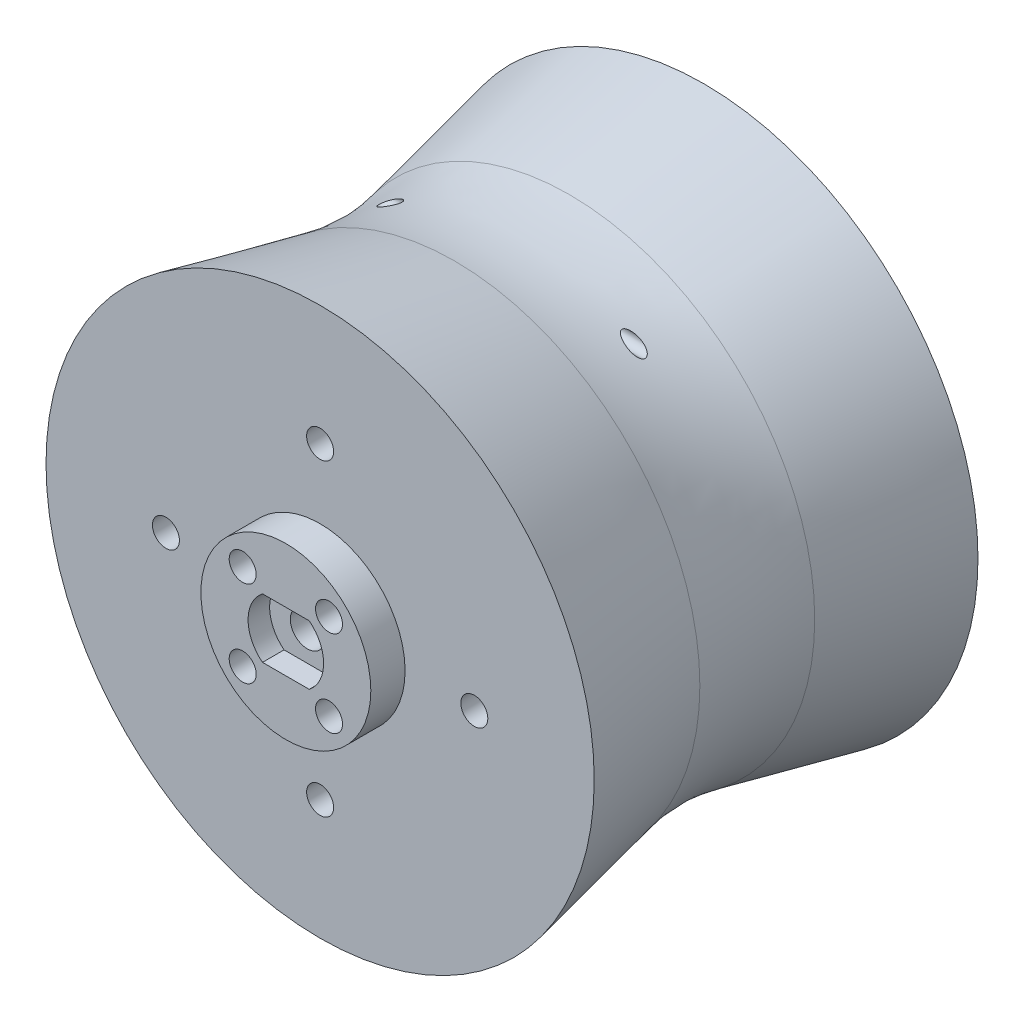
from build123d import *

# Parameters (mm, degrees)
SKETCH1_R               = 50.8
SKETCH1_R_2             = 3.175
BOSS_EXTRUDE1_DEPTH     = 71.12
CUT_EXTRUDE1_DEPTH      = 102.09072361
CUT_EXTRUDE1_DEPTH_BACK = 102.09072361
SKETCH2_R               = 1.27
SKETCH7_R               = 2.5
CUT_EXTRUDE4_DEPTH      = 12.7
SKETCH8_R               = 15.748
SKETCH8_R_2             = 3.175
BOSS_EXTRUDE2_DEPTH     = 6.35
CUT_EXTRUDE6_DEPTH      = 4
SKETCH6_R               = 2.5
CUT_EXTRUDE7_DEPTH      = 7


with BuildPart() as part:
    # Sketch1 → Boss-Extrude1 (new body)
    with BuildSketch(Plane.XY):
        Circle(SKETCH1_R)
        Circle(SKETCH1_R_2, mode=Mode.SUBTRACT)
    extrude(amount=BOSS_EXTRUDE1_DEPTH)

    # Sketch2 → Cut-Extrude1 (cut, two sides: drawn at the far end of the back side and taken through both)
    with BuildSketch(Plane(origin=(0, 0, 0), x_dir=(0, 0, -1), z_dir=(1, 0, 0)).offset(-CUT_EXTRUDE1_DEPTH_BACK)):
        with Locations((-35.56, 38.1)):
            Circle(SKETCH2_R)
    extrude(amount=CUT_EXTRUDE1_DEPTH + CUT_EXTRUDE1_DEPTH_BACK, mode=Mode.SUBTRACT)

    # Sketch7 → Cut-Extrude4 (cut)
    with BuildSketch(Plane(origin=(0, 0, 0), x_dir=(-1, 0, 0), z_dir=(0, 0, -1))):
        with Locations((28.575, 0)):
            Circle(SKETCH7_R)
        with Locations((0, 28.575)):
            Circle(SKETCH7_R)
        with Locations((-28.575, 0)):
            Circle(SKETCH7_R)
        with Locations((0, -28.575)):
            Circle(SKETCH7_R)
    cut_extrude4 = extrude(amount=-CUT_EXTRUDE4_DEPTH, mode=Mode.SUBTRACT)

    # Mirror1: Cut-Extrude4 across plane
    add(cut_extrude4.mirror(Plane.XY.offset(35.56)), mode=Mode.SUBTRACT)

    # Sketch8 → Boss-Extrude2 (add)
    with BuildSketch(Plane.XY.offset(71.12)):
        Circle(SKETCH8_R)
        Circle(SKETCH8_R_2, mode=Mode.SUBTRACT)
    extrude(amount=BOSS_EXTRUDE2_DEPTH)

    # Sketch5 → Cut-Extrude6 (cut)
    with BuildSketch(Plane.XY.offset(77.47)):
        with BuildLine():
            Line((-4.330127019, 5.5), (4.330127019, 5.5))
            ThreePointArc((4.330127019, 5.5), (7, 0), (4.330127019, -5.5))
            Line((4.330127019, -5.5), (-4.330127019, -5.5))
            ThreePointArc((-4.330127019, -5.5), (-7, 0), (-4.330127019, 5.5))
        make_face()
    extrude(amount=-CUT_EXTRUDE6_DEPTH, mode=Mode.SUBTRACT)

    # Sketch6 → Cut-Extrude7 (cut)
    with BuildSketch(Plane.XY.offset(77.47)):
        with Locations((-8, 8)):
            Circle(SKETCH6_R)
        with Locations((8, 8)):
            Circle(SKETCH6_R)
        with Locations((8, -8)):
            Circle(SKETCH6_R)
        with Locations((-8, -8)):
            Circle(SKETCH6_R)
    extrude(amount=-CUT_EXTRUDE7_DEPTH, mode=Mode.SUBTRACT)

    # Sketch9 → Cut-Revolve1 (revolve, cut)
    with BuildSketch(Plane(origin=(0, 0, 0), x_dir=(0, 0, -1), z_dir=(1, 0, 0)), mode=Mode.PRIVATE) as cut_revolve1_sk:
        with BuildLine():
            Line((-71.12, 50.8), (-46.204077708, 45.460873794))
            ThreePointArc((-46.204077708, 45.460873794), (-35.56, 44.33323643), (-24.915922292, 45.460873794))
            Line((-24.915922292, 45.460873794), (0, 50.8))
            Line((0, 50.8), (-71.12, 50.8))
        make_face()
    revolve(cut_revolve1_sk.sketch.rotate(Axis((0, 0, -3.8735), (0, 0, 1)), 90), axis=Axis((0, 0, -3.8735), (0, 0, 1)), mode=Mode.SUBTRACT)


solid = part.part
